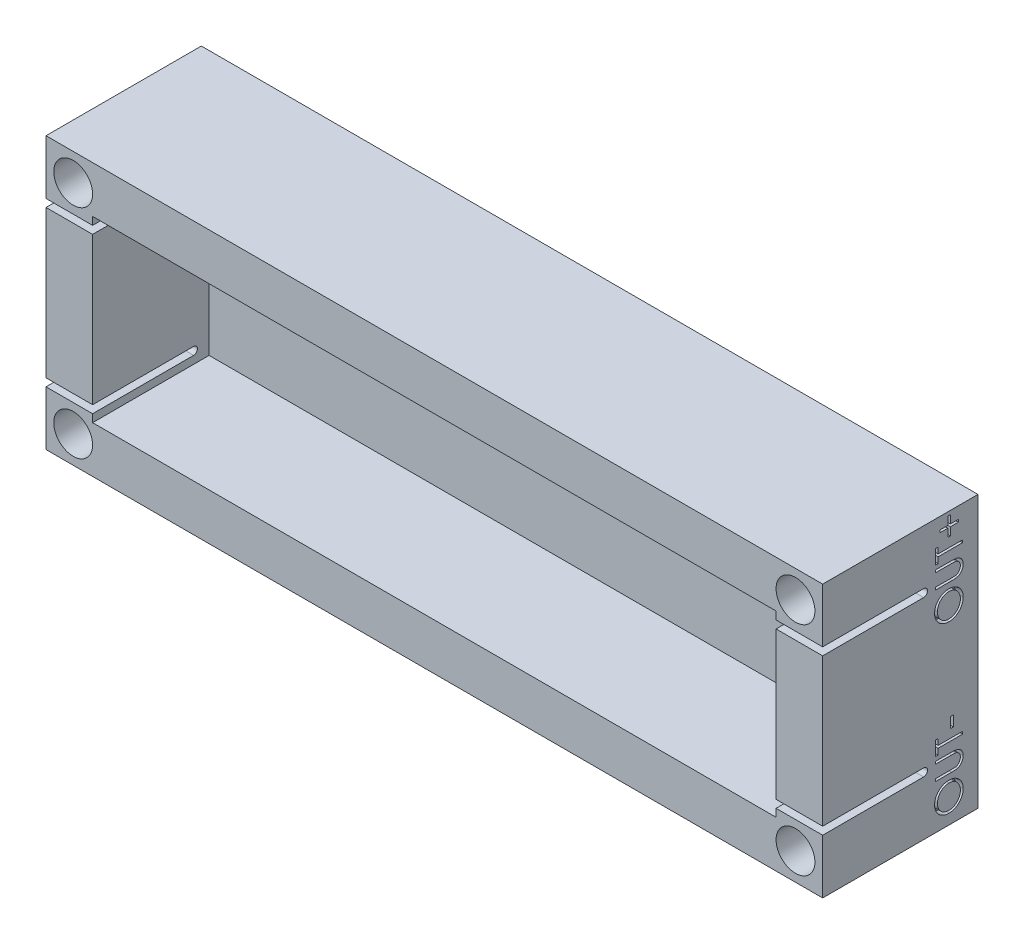
from build123d import *

# Parameters (mm, degrees)
SKETCH1_W           = 100
SKETCH1_H           = 35
BOSS_EXTRUDE1_DEPTH = 5
SKETCH2_W           = 100
SKETCH2_H           = 35
SKETCH2_W_2         = 88
SKETCH2_H_2         = 23
BOSS_EXTRUDE2_DEPTH = 15
CUT_EXTRUDE1_DEPTH  = 104.471010433
SKETCH4_W           = 3.5
SKETCH4_H           = 0.314102564
SKETCH4_W_2         = 0.358974359
SKETCH4_H_2         = 1.346153846
CUT_EXTRUDE2_DEPTH  = 1
SKETCH5_W           = 0.358974359
SKETCH5_H           = 1.346153846
CUT_EXTRUDE3_DEPTH  = 1
SKETCH6_R           = 2.5
CUT_EXTRUDE4_DEPTH  = 5


with BuildPart() as part:
    # Sketch1 → Boss-Extrude1 (new body)
    with BuildSketch(Plane.XY):
        Rectangle(SKETCH1_W, SKETCH1_H)
    extrude(amount=BOSS_EXTRUDE1_DEPTH)

    # Sketch2 → Boss-Extrude2 (add)
    with BuildSketch(Plane.XY.offset(5)):
        Rectangle(SKETCH2_W, SKETCH2_H)
        Rectangle(SKETCH2_W_2, SKETCH2_H_2, mode=Mode.SUBTRACT)
    extrude(amount=BOSS_EXTRUDE2_DEPTH)

    # Sketch3 → Cut-Extrude1 (cut, through all)
    with BuildSketch(Plane.ZY.offset(50)):
        with BuildLine():
            Line((20, 9.5), (7, 9.5))
            ThreePointArc((7, 9.5), (6.5, 10), (7, 10.5))
            Line((7, 10.5), (20, 10.5))
            ThreePointArc((20, 10.5), (20.5, 10), (20, 9.5))
        make_face()
        with BuildLine():
            Line((20, -10.5), (7, -10.5))
            ThreePointArc((7, -10.5), (6.5, -10), (7, -9.5))
            Line((7, -9.5), (20, -9.5))
            ThreePointArc((20, -9.5), (20.5, -10), (20, -10.5))
        make_face()
    extrude(amount=-CUT_EXTRUDE1_DEPTH, mode=Mode.SUBTRACT)

    # Sketch4 → Cut-Extrude2 (cut)
    with BuildSketch(Plane.ZY.offset(50)):
        with Locations((3.75, 12.425221733)):
            Rectangle(SKETCH4_W, SKETCH4_H)
        Polygon((2, 11.505349938), (5.5, 11.505349938), (5.5, 11.43944449), (2.745292468, 9.12714481), (5.5, 9.12714481), (5.5, 8.813042246), (2, 8.813042246), (2, 8.884556669), (4.748397436, 11.191247374), (2, 11.191247374), align=None)
        Polygon((3.884615385, 7.063042246), (4.916666667, 7.063042246), (4.916666667, 6.748939682), (3.884615385, 6.748939682), (3.884615385, 5.7168884), (3.570512821, 5.7168884), (3.570512821, 6.748939682), (2.538461538, 6.748939682), (2.538461538, 7.063042246), (3.570512821, 7.063042246), (3.570512821, 8.095093528), (3.884615385, 8.095093528), align=None)
        with Locations((3.75, -8.085547974)):
            Rectangle(SKETCH4_W, SKETCH4_H)
        Polygon((2, -9.005419769), (5.5, -9.005419769), (5.5, -9.071325218), (2.745292468, -11.383624897), (5.5, -11.383624897), (5.5, -11.697727461), (2, -11.697727461), (2, -11.626213038), (4.748397436, -9.319522333), (2, -9.319522333), align=None)
        with Locations((3.346153847, -12.954137718)):
            Rectangle(SKETCH4_W_2, SKETCH4_H_2)
    extrude(amount=-CUT_EXTRUDE2_DEPTH, mode=Mode.SUBTRACT)

    # Sketch5 → Cut-Extrude3 (cut)
    # profile 1 of 8: a face of its own
    with BuildSketch(Plane(origin=(50, 0, 0), x_dir=(0, 0, -1), z_dir=(1, 0, 0))):
        with BuildLine():
            add(Edge.make_bspline(
                [(-5.58974359, -14.357953129), (-5.588129744, -14.293137957), (-5.584960018, -14.165835611), (-5.559895231, -13.978914089), (-5.518641215, -13.799928351), (-5.460381735, -13.628775498), (-5.384855641, -13.466106469), (-5.293113066, -13.311461843), (-5.184596472, -13.165305074), (-5.060899323, -13.028642218), (-4.925430757, -12.903974033), (-4.780409088, -12.794577053), (-4.62765762, -12.702290377), (-4.467168388, -12.626743681), (-4.299316087, -12.567434518), (-4.123159994, -12.526518352), (-3.939853875, -12.500379416), (-3.814826932, -12.497323746), (-3.751402244, -12.495773642)],
                knots=[0, 0, 0, 0, 1.065064174, 2.09187391, 3.093564831, 4.079973196, 5.057907931, 6.036227367, 7.030399151, 8.044883615, 9.061699972, 10.052012555, 11.025713132, 11.989727027, 12.962874294, 13.945865945, 14.957962116, 16, 16, 16, 16], degree=3))
            add(Edge.make_bspline(
                [(-3.751402244, -12.495773642), (-3.688445124, -12.497324268), (-3.564349346, -12.500380733), (-3.382201223, -12.526539561), (-3.207127705, -12.567617088), (-3.039519009, -12.626009353), (-2.879355736, -12.70161402), (-2.726488631, -12.794036556), (-2.581079609, -12.903225913), (-2.444677774, -13.027364693), (-2.319901677, -13.163091329), (-2.2098443, -13.307555638), (-2.11751745, -13.460303032), (-2.041127343, -13.619750597), (-1.983054174, -13.787150366), (-1.94077499, -13.961284167), (-1.914895539, -14.14310074), (-1.911819755, -14.26695579), (-1.91025641, -14.329908257)],
                knots=[0, 0, 0, 0, 1.043748596, 2.057349401, 3.045489418, 4.02252776, 4.995289225, 5.97782527, 6.980224157, 8.006516136, 9.032559198, 10.034193337, 11.013412982, 11.987833483, 12.961212594, 13.946489799, 14.956251404, 16, 16, 16, 16], degree=3))
            add(Edge.make_bspline(
                [(-1.91025641, -14.329908257), (-1.911805797, -14.393332576), (-1.914860051, -14.518358792), (-1.941041456, -14.701895827), (-1.98198276, -14.878173571), (-2.040492196, -15.046687922), (-2.116109427, -15.207532852), (-2.208313806, -15.361022935), (-2.317720947, -15.506542082), (-2.441887521, -15.642883828), (-2.577059073, -15.767633027), (-2.721893329, -15.876392402), (-2.873548785, -15.968617516), (-3.032446309, -16.043980848), (-3.197817752, -16.103645307), (-3.370766229, -16.144350126), (-3.550305735, -16.170686078), (-3.672548634, -16.173720924), (-3.734575321, -16.175260821)],
                knots=[0, 0, 0, 0, 1.053102029, 2.075944431, 3.073151272, 4.055350789, 5.033113405, 6.020478099, 7.024410459, 8.052272461, 9.079885166, 10.07527673, 11.055994387, 12.023226415, 12.992069828, 13.970394897, 14.97016774, 16, 16, 16, 16], degree=3))
            add(Edge.make_bspline(
                [(-3.734575321, -16.175260821), (-3.77620799, -16.174726186), (-3.858948113, -16.173663659), (-3.981814713, -16.160871967), (-4.102705371, -16.142310266), (-4.221276319, -16.115708353), (-4.337237304, -16.080916686), (-4.451388067, -16.039864659), (-4.56257179, -15.989724813), (-4.671315182, -15.933044165), (-4.775923088, -15.869782357), (-4.874802671, -15.799906608), (-4.968783668, -15.725871239), (-5.055430672, -15.644707846), (-5.137264328, -15.559091401), (-5.213027045, -15.467633022), (-5.283401996, -15.370890778), (-5.346822337, -15.268448398), (-5.404181472, -15.162830123), (-5.453403323, -15.053953346), (-5.495649384, -14.943296774), (-5.529890209, -14.830342126), (-5.556922245, -14.715389354), (-5.575329599, -14.598187569), (-5.588153917, -14.478830143), (-5.589211419, -14.398418824), (-5.58974359, -14.357953129)],
                knots=[0, 0, 0, 0, 1.037015668, 2.060948919, 3.074880161, 4.083647147, 5.086022904, 6.090072063, 7.104153813, 8.122640571, 9.144368836, 10.147691507, 11.138137339, 12.123020368, 13.103399296, 14.087645067, 15.080126199, 16.082011238, 17.087798457, 18.072939717, 19.057185487, 20.037253025, 21.01195951, 21.997135196, 22.992090687, 24, 24, 24, 24], degree=3))
        make_face()
        with BuildLine():
            add(Edge.make_bspline(
                [(-5.230769231, -14.342528449), (-5.230365753, -14.375743508), (-5.229562654, -14.441856086), (-5.21892606, -14.540134342), (-5.203874783, -14.637149922), (-5.182015052, -14.732715087), (-5.153740439, -14.827030256), (-5.119639024, -14.9201373), (-5.078422353, -15.011716987), (-5.032069199, -15.101654907), (-4.979419431, -15.187873789), (-4.92351052, -15.270581273), (-4.862265147, -15.347626067), (-4.797007836, -15.420066552), (-4.727172255, -15.487722574), (-4.653217023, -15.550564292), (-4.574822262, -15.608540172), (-4.492310601, -15.660952501), (-4.40614272, -15.707595382), (-4.317965778, -15.749356709), (-4.226743513, -15.783975256), (-4.133045178, -15.811398302), (-4.037283681, -15.834674186), (-3.93893728, -15.849274542), (-3.838345009, -15.86001594), (-3.770362768, -15.860774553), (-3.735977564, -15.861158257)],
                knots=[0, 0, 0, 0, 1.008406545, 2.007172654, 2.999155034, 3.989332444, 4.982025741, 5.988181096, 6.998684226, 8.030553839, 9.059268815, 10.065399129, 11.060956322, 12.046057109, 13.024974577, 14.012068307, 14.991706172, 15.984221787, 16.978487447, 17.966117052, 18.945677757, 19.938371053, 20.93015022, 21.936155317, 22.956113857, 24, 24, 24, 24], degree=3))
            add(Edge.make_bspline(
                [(-3.735977564, -15.861158257), (-3.685416493, -15.859880478), (-3.585947224, -15.857366692), (-3.440162679, -15.835450738), (-3.299921154, -15.801424055), (-3.166058545, -15.752091792), (-3.037977921, -15.689158755), (-2.916177726, -15.612393227), (-2.80069389, -15.521092197), (-2.692386073, -15.417443244), (-2.593568594, -15.304105846), (-2.50670751, -15.183815892), (-2.433602799, -15.057525071), (-2.372488904, -14.92596129), (-2.326448237, -14.788001281), (-2.293621264, -14.64452959), (-2.272345169, -14.495543047), (-2.270278754, -14.394017352), (-2.269230769, -14.342528449)],
                knots=[0, 0, 0, 0, 1.032022337, 2.030307203, 3.003823408, 3.974715386, 4.937372378, 5.913284036, 6.909147208, 7.938749767, 8.970518239, 9.975863271, 10.963918693, 11.946286286, 12.933361397, 13.927862637, 14.949112547, 16, 16, 16, 16], degree=3))
            add(Edge.make_bspline(
                [(-2.269230769, -14.342528449), (-2.26970589, -14.307918812), (-2.270648197, -14.239277505), (-2.280152496, -14.137183979), (-2.295363267, -14.036920277), (-2.317371822, -13.938671652), (-2.344552167, -13.842309379), (-2.378266584, -13.748124215), (-2.418682089, -13.656147443), (-2.463723833, -13.565926794), (-2.514890039, -13.479482395), (-2.570045247, -13.397276596), (-2.630209968, -13.320364538), (-2.694590845, -13.247958042), (-2.764211752, -13.180776173), (-2.837717532, -13.118113379), (-2.916278677, -13.061139918), (-2.99845239, -13.008905268), (-3.083992054, -12.961693273), (-3.172411414, -12.921139904), (-3.263236245, -12.886506487), (-3.356533279, -12.85858803), (-3.452092652, -12.836699855), (-3.550051131, -12.821620672), (-3.650210365, -12.811072034), (-3.717954236, -12.810276984), (-3.752103365, -12.809876206)],
                knots=[0, 0, 0, 0, 1.047334373, 2.07717862, 3.100662057, 4.115010574, 5.122652213, 6.129548646, 7.140165612, 8.16200981, 9.179904151, 10.178566626, 11.156366481, 12.133321541, 13.108841334, 14.082538371, 15.054589433, 16.043660176, 17.028268541, 18.009491307, 18.985652105, 19.968123554, 20.954864208, 21.950389976, 22.966808393, 24, 24, 24, 24], degree=3))
            add(Edge.make_bspline(
                [(-3.752103365, -12.809876206), (-3.78601887, -12.810277319), (-3.85329652, -12.811073), (-3.952757338, -12.821615475), (-4.05001055, -12.836716365), (-4.144674352, -12.858479073), (-4.236772879, -12.886529226), (-4.326219621, -12.92111656), (-4.413347837, -12.961901846), (-4.497942055, -13.008710124), (-4.579117087, -13.061325747), (-4.65671841, -13.118820733), (-4.729295218, -13.182183309), (-4.798614701, -13.249619703), (-4.863290324, -13.322751233), (-4.923072192, -13.401590662), (-4.980653876, -13.484174991), (-5.031614304, -13.572371804), (-5.0789118, -13.663067572), (-5.119263823, -13.756217214), (-5.153920496, -13.850490416), (-5.182099457, -13.946264101), (-5.20379105, -14.043492997), (-5.218939529, -14.142120562), (-5.229559, -14.241802531), (-5.23036454, -14.308846597), (-5.230769231, -14.342528449)],
                knots=[0, 0, 0, 0, 1.029877221, 2.042951179, 3.035109885, 4.018542222, 4.991021277, 5.957494829, 6.929429462, 7.911425532, 8.892163142, 9.866273635, 10.842761649, 11.81676864, 12.802607151, 13.805177466, 14.821356543, 15.858816981, 16.897175917, 17.927346774, 18.940346092, 19.946830556, 20.957962087, 21.964146003, 22.97721996, 24, 24, 24, 24], degree=3))
        make_face(mode=Mode.SUBTRACT)
    # profile 2 of 8: a face of its own
    with BuildSketch(Plane(origin=(50, 0, 0), x_dir=(0, 0, -1), z_dir=(1, 0, 0))):
        with BuildLine():
            Line((-5.5, -11.777824924), (-5.5, -11.46372236))
            Line((-5.5, -11.46372236), (-3.402944712, -11.46372236))
            add(Edge.make_bspline(
                [(-3.402944712, -11.46372236), (-3.373263976, -11.463769104), (-3.316939665, -11.463857808), (-3.236771364, -11.463265294), (-3.165498905, -11.461605926), (-3.102847558, -11.460559766), (-3.04910481, -11.458232433), (-3.0039795, -11.456334386), (-2.967685297, -11.453893829), (-2.946504371, -11.450960712), (-2.93739984, -11.449699924)],
                knots=[0, 0, 0, 0, 1.528628734, 2.90083645, 4.128790002, 5.200304208, 6.127813768, 6.898992206, 7.526736466, 8, 8, 8, 8], degree=3))
            add(Edge.make_bspline(
                [(-2.93739984, -11.449699924), (-2.904301233, -11.44458144), (-2.840405861, -11.434700439), (-2.749483191, -11.408448462), (-2.667388274, -11.373450347), (-2.592269338, -11.330033093), (-2.524603772, -11.275175204), (-2.463872235, -11.207067441), (-2.408682704, -11.126930884), (-2.360565368, -11.035913656), (-2.320599866, -10.93893464), (-2.290695413, -10.839470532), (-2.272393907, -10.739440988), (-2.27028033, -10.672463062), (-2.269230769, -10.639203129)],
                knots=[0, 0, 0, 0, 1.042777144, 2.01303441, 2.939567723, 3.817555404, 4.708046775, 5.641195415, 6.651191522, 7.732783915, 8.843021186, 9.914367358, 10.964315445, 12, 12, 12, 12], degree=3))
            add(Edge.make_bspline(
                [(-2.269230769, -10.639203129), (-2.270298667, -10.610646878), (-2.272428294, -10.55369931), (-2.285778381, -10.469130267), (-2.309364144, -10.38650458), (-2.341492259, -10.306471347), (-2.381001228, -10.230331242), (-2.428332331, -10.160036403), (-2.483463899, -10.097040813), (-2.544564893, -10.039553827), (-2.613418648, -9.98978865), (-2.688364059, -9.945788452), (-2.771399511, -9.910844206), (-2.82971969, -9.89315204), (-2.859575321, -9.884094956)],
                knots=[0, 0, 0, 0, 0.994718802, 1.98369237, 2.973235266, 3.981451368, 4.982709966, 5.955777334, 6.925228988, 7.892833478, 8.871333226, 9.877970804, 10.913677552, 12, 12, 12, 12], degree=3))
            add(Edge.make_bspline(
                [(-2.859575321, -9.884094956), (-2.871923895, -9.88109483), (-2.899441495, -9.874409342), (-2.945962785, -9.868162297), (-3.000852149, -9.861655772), (-3.064503962, -9.857141202), (-3.136704935, -9.852739981), (-3.217831192, -9.850106909), (-3.307588153, -9.848889876), (-3.370225315, -9.848527195), (-3.402944712, -9.848337744)],
                knots=[0, 0, 0, 0, 0.558680831, 1.244966039, 2.062412453, 2.990489873, 4.051219941, 5.244515665, 6.560634259, 8, 8, 8, 8], degree=3))
            Line((-3.402944712, -9.848337744), (-5.5, -9.848337744))
            Line((-5.5, -9.848337744), (-5.5, -9.53423518))
            Line((-5.5, -9.53423518), (-3.386117788, -9.53423518))
            add(Edge.make_bspline(
                [(-3.386117788, -9.53423518), (-3.348019417, -9.534489337), (-3.273668129, -9.534985339), (-3.164716665, -9.539285413), (-3.061364054, -9.546144188), (-2.963594286, -9.555826179), (-2.87176449, -9.5686841), (-2.785269805, -9.582850596), (-2.704587107, -9.601206878), (-2.628785526, -9.622488999), (-2.556264884, -9.646471043), (-2.48757401, -9.678077853), (-2.420695446, -9.713533552), (-2.356378054, -9.755245314), (-2.29503047, -9.80323288), (-2.235064641, -9.855657792), (-2.178267709, -9.914367875), (-2.123939175, -9.977629019), (-2.073413625, -10.045015885), (-2.029444943, -10.116963589), (-1.993642513, -10.193074915), (-1.961867151, -10.271547603), (-1.939282033, -10.354263081), (-1.922109536, -10.440191011), (-1.912434071, -10.529841074), (-1.910988451, -10.590804235), (-1.91025641, -10.621675084)],
                knots=[0, 0, 0, 0, 1.316707045, 2.569633854, 3.76780728, 4.896239288, 5.964314126, 6.972204208, 7.924543903, 8.822147865, 9.693191779, 10.560896119, 11.431827672, 12.307838457, 13.206132673, 14.12176355, 15.058527151, 16.026630406, 17.00238624, 17.966538933, 18.934743273, 19.906713913, 20.888635248, 21.892958714, 22.933025263, 24, 24, 24, 24], degree=3))
            add(Edge.make_bspline(
                [(-1.91025641, -10.621675084), (-1.911040632, -10.655344432), (-1.912579271, -10.721403574), (-1.921409724, -10.818738158), (-1.938000049, -10.912065047), (-1.95926136, -11.002295087), (-1.988105864, -11.088556554), (-2.023548065, -11.170824029), (-2.064010724, -11.250042114), (-2.111823734, -11.324426043), (-2.163960603, -11.394586012), (-2.221227237, -11.458345382), (-2.281442629, -11.51732269), (-2.346874192, -11.568918349), (-2.416182481, -11.615083876), (-2.489693486, -11.654801993), (-2.567308662, -11.688918466), (-2.621262289, -11.706524594), (-2.64853766, -11.715425084)],
                knots=[0, 0, 0, 0, 1.138939089, 2.234594419, 3.301501784, 4.342532435, 5.367382236, 6.373123747, 7.370098489, 8.372230273, 9.360297234, 10.323289009, 11.268038109, 12.20748145, 13.137029304, 14.081414587, 15.030090602, 16, 16, 16, 16], degree=3))
            add(Edge.make_bspline(
                [(-2.64853766, -11.715425084), (-2.667170235, -11.720602242), (-2.707584704, -11.731831613), (-2.774471192, -11.743856911), (-2.85148611, -11.753965993), (-2.938634728, -11.763471551), (-3.035984595, -11.769080509), (-3.143493511, -11.773997948), (-3.261291472, -11.777859566), (-3.343345988, -11.777836794), (-3.386117788, -11.777824924)],
                knots=[0, 0, 0, 0, 0.625038921, 1.35572334, 2.194682327, 3.136881307, 4.189498639, 5.346923369, 6.617055217, 8, 8, 8, 8], degree=3))
            Line((-3.386117788, -11.777824924), (-5.5, -11.777824924))
        make_face()
    # profile 3 of 8: a face of its own
    with BuildSketch(Plane(origin=(50, 0, 0), x_dir=(0, 0, -1), z_dir=(1, 0, 0))):
        Polygon((-5.141025641, -8.995773642), (-5.5, -8.995773642), (-5.5, -7.156030052), (-5.141025641, -7.156030052), (-5.141025641, -7.918850565), (-2, -7.918850565), (-2, -8.232953129), (-5.141025641, -8.232953129), align=None)
    # profile 4 of 8: a face of its own
    with BuildSketch(Plane(origin=(50, 0, 0), x_dir=(0, 0, -1), z_dir=(1, 0, 0))):
        with Locations((-3.346153847, -6.168850565)):
            Rectangle(SKETCH5_W, SKETCH5_H)
    # profile 5 of 8: a face of its own
    with BuildSketch(Plane(origin=(50, 0, 0), x_dir=(0, 0, -1), z_dir=(1, 0, 0))):
        with BuildLine():
            add(Edge.make_bspline(
                [(-5.58974359, 6.98971256), (-5.588129744, 7.054527732), (-5.584960018, 7.181830077), (-5.559895231, 7.368751599), (-5.518641215, 7.547737338), (-5.460381735, 7.71889019), (-5.384855641, 7.881559219), (-5.293113066, 8.036203845), (-5.184596472, 8.182360614), (-5.060899323, 8.31902347), (-4.925430757, 8.443691655), (-4.780409088, 8.553088635), (-4.62765762, 8.645375311), (-4.467168388, 8.720922007), (-4.299316087, 8.78023117), (-4.123159994, 8.821147336), (-3.939853875, 8.847286273), (-3.814826932, 8.850341942), (-3.751402244, 8.851892047)],
                knots=[0, 0, 0, 0, 1.065064174, 2.09187391, 3.093564831, 4.079973196, 5.057907931, 6.036227367, 7.030399151, 8.044883615, 9.061699972, 10.052012555, 11.025713132, 11.989727027, 12.962874294, 13.945865945, 14.957962116, 16, 16, 16, 16], degree=3))
            add(Edge.make_bspline(
                [(-3.751402244, 8.851892047), (-3.688445124, 8.85034142), (-3.564349346, 8.847284956), (-3.382201223, 8.821126127), (-3.207127705, 8.7800486), (-3.039519009, 8.721656335), (-2.879355736, 8.646051668), (-2.726488631, 8.553629132), (-2.581079609, 8.444439775), (-2.444677774, 8.320300995), (-2.319901677, 8.18457436), (-2.2098443, 8.04011005), (-2.11751745, 7.887362656), (-2.041127343, 7.727915091), (-1.983054174, 7.560515322), (-1.94077499, 7.386381521), (-1.914895539, 7.204564948), (-1.911819755, 7.080709899), (-1.91025641, 7.017757431)],
                knots=[0, 0, 0, 0, 1.043748596, 2.057349401, 3.045489418, 4.02252776, 4.995289225, 5.97782527, 6.980224157, 8.006516136, 9.032559198, 10.034193337, 11.013412982, 11.987833483, 12.961212594, 13.946489799, 14.956251404, 16, 16, 16, 16], degree=3))
            add(Edge.make_bspline(
                [(-1.91025641, 7.017757431), (-1.911805797, 6.954333112), (-1.914860051, 6.829306896), (-1.941041456, 6.645769861), (-1.98198276, 6.469492117), (-2.040492196, 6.300977766), (-2.116109427, 6.140132836), (-2.208313806, 5.986642754), (-2.317720947, 5.841123606), (-2.441887521, 5.70478186), (-2.577059073, 5.580032662), (-2.721893329, 5.471273286), (-2.873548785, 5.379048173), (-3.032446309, 5.30368484), (-3.197817752, 5.244020381), (-3.370766229, 5.203315563), (-3.550305735, 5.176979611), (-3.672548634, 5.173944764), (-3.734575321, 5.172404867)],
                knots=[0, 0, 0, 0, 1.053102029, 2.075944431, 3.073151272, 4.055350789, 5.033113405, 6.020478099, 7.024410459, 8.052272461, 9.079885166, 10.07527673, 11.055994387, 12.023226415, 12.992069828, 13.970394897, 14.97016774, 16, 16, 16, 16], degree=3))
            add(Edge.make_bspline(
                [(-3.734575321, 5.172404867), (-3.77620799, 5.172939503), (-3.858948113, 5.174002029), (-3.981814713, 5.186793722), (-4.102705371, 5.205355423), (-4.221276319, 5.231957335), (-4.337237304, 5.266749002), (-4.451388067, 5.30780103), (-4.56257179, 5.357940875), (-4.671315182, 5.414621523), (-4.775923088, 5.477883331), (-4.874802671, 5.547759081), (-4.968783668, 5.621794449), (-5.055430672, 5.702957843), (-5.137264328, 5.788574288), (-5.213027045, 5.880032666), (-5.283401996, 5.97677491), (-5.346822337, 6.07921729), (-5.404181472, 6.184835565), (-5.453403323, 6.293712343), (-5.495649384, 6.404368914), (-5.529890209, 6.517323562), (-5.556922245, 6.632276334), (-5.575329599, 6.749478119), (-5.588153917, 6.868835545), (-5.589211419, 6.949246864), (-5.58974359, 6.98971256)],
                knots=[0, 0, 0, 0, 1.037015668, 2.060948919, 3.074880161, 4.083647147, 5.086022904, 6.090072063, 7.104153813, 8.122640571, 9.144368836, 10.147691507, 11.138137339, 12.123020368, 13.103399296, 14.087645067, 15.080126199, 16.082011238, 17.087798457, 18.072939717, 19.057185487, 20.037253025, 21.01195951, 21.997135196, 22.992090687, 24, 24, 24, 24], degree=3))
        make_face()
        with BuildLine():
            add(Edge.make_bspline(
                [(-5.230769231, 7.005137239), (-5.230365753, 6.971922181), (-5.229562654, 6.905809602), (-5.21892606, 6.807531346), (-5.203874783, 6.710515766), (-5.182015052, 6.614950601), (-5.153740439, 6.520635433), (-5.119639024, 6.427528388), (-5.078422353, 6.335948702), (-5.032069199, 6.246010782), (-4.979419431, 6.159791899), (-4.92351052, 6.077084415), (-4.862265147, 6.000039621), (-4.797007836, 5.927599136), (-4.727172255, 5.859943114), (-4.653217023, 5.797101396), (-4.574822262, 5.739125516), (-4.492310601, 5.686713187), (-4.40614272, 5.640070306), (-4.317965778, 5.598308979), (-4.226743513, 5.563690433), (-4.133045178, 5.536267386), (-4.037283681, 5.512991503), (-3.93893728, 5.498391146), (-3.838345009, 5.487649749), (-3.770362768, 5.486891136), (-3.735977564, 5.486507431)],
                knots=[0, 0, 0, 0, 1.008406545, 2.007172654, 2.999155034, 3.989332444, 4.982025741, 5.988181096, 6.998684226, 8.030553839, 9.059268815, 10.065399129, 11.060956322, 12.046057109, 13.024974577, 14.012068307, 14.991706172, 15.984221787, 16.978487447, 17.966117052, 18.945677757, 19.938371053, 20.93015022, 21.936155317, 22.956113857, 24, 24, 24, 24], degree=3))
            add(Edge.make_bspline(
                [(-3.735977564, 5.486507431), (-3.685416493, 5.48778521), (-3.585947224, 5.490298996), (-3.440162679, 5.51221495), (-3.299921154, 5.546241633), (-3.166058545, 5.595573897), (-3.037977921, 5.658506933), (-2.916177726, 5.735272461), (-2.80069389, 5.826573491), (-2.692386073, 5.930222444), (-2.593568594, 6.043559842), (-2.50670751, 6.163849796), (-2.433602799, 6.290140618), (-2.372488904, 6.421704399), (-2.326448237, 6.559664407), (-2.293621264, 6.703136098), (-2.272345169, 6.852122642), (-2.270278754, 6.953648336), (-2.269230769, 7.005137239)],
                knots=[0, 0, 0, 0, 1.032022337, 2.030307203, 3.003823408, 3.974715386, 4.937372378, 5.913284036, 6.909147208, 7.938749767, 8.970518239, 9.975863271, 10.963918693, 11.946286286, 12.933361397, 13.927862637, 14.949112547, 16, 16, 16, 16], degree=3))
            add(Edge.make_bspline(
                [(-2.269230769, 7.005137239), (-2.26970589, 7.039746877), (-2.270648197, 7.108388183), (-2.280152496, 7.21048171), (-2.295363267, 7.310745412), (-2.317371822, 7.408994036), (-2.344552167, 7.50535631), (-2.378266584, 7.599541474), (-2.418682089, 7.691518245), (-2.463723833, 7.781738894), (-2.514890039, 7.868183293), (-2.570045247, 7.950389092), (-2.630209968, 8.02730115), (-2.694590845, 8.099707647), (-2.764211752, 8.166889515), (-2.837717532, 8.229552309), (-2.916278677, 8.286525771), (-2.99845239, 8.33876042), (-3.083992054, 8.385972416), (-3.172411414, 8.426525785), (-3.263236245, 8.461159201), (-3.356533279, 8.489077658), (-3.452092652, 8.510965833), (-3.550051131, 8.526045017), (-3.650210365, 8.536593654), (-3.717954236, 8.537388704), (-3.752103365, 8.537789483)],
                knots=[0, 0, 0, 0, 1.047334373, 2.07717862, 3.100662057, 4.115010574, 5.122652213, 6.129548646, 7.140165612, 8.16200981, 9.179904151, 10.178566626, 11.156366481, 12.133321541, 13.108841334, 14.082538371, 15.054589433, 16.043660176, 17.028268541, 18.009491307, 18.985652105, 19.968123554, 20.954864208, 21.950389976, 22.966808393, 24, 24, 24, 24], degree=3))
            add(Edge.make_bspline(
                [(-3.752103365, 8.537789483), (-3.78601887, 8.53738837), (-3.85329652, 8.536592688), (-3.952757338, 8.526050214), (-4.05001055, 8.510949323), (-4.144674352, 8.489186615), (-4.236772879, 8.461136462), (-4.326219621, 8.426549128), (-4.413347837, 8.385763843), (-4.497942055, 8.338955565), (-4.579117087, 8.286339941), (-4.65671841, 8.228844955), (-4.729295218, 8.16548238), (-4.798614701, 8.098045986), (-4.863290324, 8.024914455), (-4.923072192, 7.946075026), (-4.980653876, 7.863490697), (-5.031614304, 7.775293884), (-5.0789118, 7.684598116), (-5.119263823, 7.591448474), (-5.153920496, 7.497175272), (-5.182099457, 7.401401588), (-5.20379105, 7.304172692), (-5.218939529, 7.205545126), (-5.229559, 7.105863157), (-5.23036454, 7.038819091), (-5.230769231, 7.005137239)],
                knots=[0, 0, 0, 0, 1.029877221, 2.042951179, 3.035109885, 4.018542222, 4.991021277, 5.957494829, 6.929429462, 7.911425532, 8.892163142, 9.866273635, 10.842761649, 11.81676864, 12.802607151, 13.805177466, 14.821356543, 15.858816981, 16.897175917, 17.927346774, 18.940346092, 19.946830556, 20.957962087, 21.964146003, 22.97721996, 24, 24, 24, 24], degree=3))
        make_face(mode=Mode.SUBTRACT)
    # profile 6 of 8: a face of its own
    with BuildSketch(Plane(origin=(50, 0, 0), x_dir=(0, 0, -1), z_dir=(1, 0, 0))):
        with BuildLine():
            Line((-5.5, 9.569840765), (-5.5, 9.883943329))
            Line((-5.5, 9.883943329), (-3.402944712, 9.883943329))
            add(Edge.make_bspline(
                [(-3.402944712, 9.883943329), (-3.373263976, 9.883896585), (-3.316939665, 9.88380788), (-3.236771364, 9.884400394), (-3.165498905, 9.886059762), (-3.102847558, 9.887105922), (-3.04910481, 9.889433255), (-3.0039795, 9.891331302), (-2.967685297, 9.893771859), (-2.946504371, 9.896704977), (-2.93739984, 9.897965765)],
                knots=[0, 0, 0, 0, 1.528628734, 2.90083645, 4.128790002, 5.200304208, 6.127813768, 6.898992206, 7.526736466, 8, 8, 8, 8], degree=3))
            add(Edge.make_bspline(
                [(-2.93739984, 9.897965765), (-2.904301233, 9.903084248), (-2.840405861, 9.91296525), (-2.749483191, 9.939217227), (-2.667388274, 9.974215341), (-2.592269338, 10.017632596), (-2.524603772, 10.072490485), (-2.463872235, 10.140598247), (-2.408682704, 10.220734804), (-2.360565368, 10.311752032), (-2.320599866, 10.408731049), (-2.290695413, 10.508195156), (-2.272393907, 10.6082247), (-2.27028033, 10.675202626), (-2.269230769, 10.70846256)],
                knots=[0, 0, 0, 0, 1.042777144, 2.01303441, 2.939567723, 3.817555404, 4.708046775, 5.641195415, 6.651191522, 7.732783915, 8.843021186, 9.914367358, 10.964315445, 12, 12, 12, 12], degree=3))
            add(Edge.make_bspline(
                [(-2.269230769, 10.70846256), (-2.270298667, 10.73701881), (-2.272428294, 10.793966378), (-2.285778381, 10.878535421), (-2.309364144, 10.961161108), (-2.341492259, 11.041194342), (-2.381001228, 11.117334446), (-2.428332331, 11.187629285), (-2.483463899, 11.250624875), (-2.544564893, 11.308111862), (-2.613418648, 11.357877039), (-2.688364059, 11.401877236), (-2.771399511, 11.436821483), (-2.82971969, 11.454513648), (-2.859575321, 11.463570733)],
                knots=[0, 0, 0, 0, 0.994718802, 1.98369237, 2.973235266, 3.981451368, 4.982709966, 5.955777334, 6.925228988, 7.892833478, 8.871333226, 9.877970804, 10.913677552, 12, 12, 12, 12], degree=3))
            add(Edge.make_bspline(
                [(-2.859575321, 11.463570733), (-2.871923895, 11.466570858), (-2.899441495, 11.473256346), (-2.945962785, 11.479503391), (-3.000852149, 11.486009917), (-3.064503962, 11.490524487), (-3.136704935, 11.494925707), (-3.217831192, 11.49755878), (-3.307588153, 11.498775813), (-3.370225315, 11.499138493), (-3.402944712, 11.499327944)],
                knots=[0, 0, 0, 0, 0.558680831, 1.244966039, 2.062412453, 2.990489873, 4.051219941, 5.244515665, 6.560634259, 8, 8, 8, 8], degree=3))
            Line((-3.402944712, 11.499327944), (-5.5, 11.499327944))
            Line((-5.5, 11.499327944), (-5.5, 11.813430508))
            Line((-5.5, 11.813430508), (-3.386117788, 11.813430508))
            add(Edge.make_bspline(
                [(-3.386117788, 11.813430508), (-3.348019417, 11.813176352), (-3.273668129, 11.81268035), (-3.164716665, 11.808380276), (-3.061364054, 11.801521501), (-2.963594286, 11.791839509), (-2.87176449, 11.778981589), (-2.785269805, 11.764815092), (-2.704587107, 11.74645881), (-2.628785526, 11.725176689), (-2.556264884, 11.701194646), (-2.48757401, 11.669587836), (-2.420695446, 11.634132137), (-2.356378054, 11.592420375), (-2.29503047, 11.544432808), (-2.235064641, 11.492007897), (-2.178267709, 11.433297813), (-2.123939175, 11.370036669), (-2.073413625, 11.302649803), (-2.029444943, 11.230702099), (-1.993642513, 11.154590773), (-1.961867151, 11.076118085), (-1.939282033, 10.993402607), (-1.922109536, 10.907474677), (-1.912434071, 10.817824615), (-1.910988451, 10.756861453), (-1.91025641, 10.725990604)],
                knots=[0, 0, 0, 0, 1.316707045, 2.569633854, 3.76780728, 4.896239288, 5.964314126, 6.972204208, 7.924543903, 8.822147865, 9.693191779, 10.560896119, 11.431827672, 12.307838457, 13.206132673, 14.12176355, 15.058527151, 16.026630406, 17.00238624, 17.966538933, 18.934743273, 19.906713913, 20.888635248, 21.892958714, 22.933025263, 24, 24, 24, 24], degree=3))
            add(Edge.make_bspline(
                [(-1.91025641, 10.725990604), (-1.911040632, 10.692321256), (-1.912579271, 10.626262115), (-1.921409724, 10.52892753), (-1.938000049, 10.435600641), (-1.95926136, 10.345370602), (-1.988105864, 10.259109134), (-2.023548065, 10.176841659), (-2.064010724, 10.097623575), (-2.111823734, 10.023239645), (-2.163960603, 9.953079676), (-2.221227237, 9.889320306), (-2.281442629, 9.830342998), (-2.346874192, 9.77874734), (-2.416182481, 9.732581812), (-2.489693486, 9.692863696), (-2.567308662, 9.658747223), (-2.621262289, 9.641141094), (-2.64853766, 9.632240604)],
                knots=[0, 0, 0, 0, 1.138939089, 2.234594419, 3.301501784, 4.342532435, 5.367382236, 6.373123747, 7.370098489, 8.372230273, 9.360297234, 10.323289009, 11.268038109, 12.20748145, 13.137029304, 14.081414587, 15.030090602, 16, 16, 16, 16], degree=3))
            add(Edge.make_bspline(
                [(-2.64853766, 9.632240604), (-2.667170235, 9.627063446), (-2.707584704, 9.615834075), (-2.774471192, 9.603808777), (-2.85148611, 9.593699696), (-2.938634728, 9.584194137), (-3.035984595, 9.578585179), (-3.143493511, 9.573667741), (-3.261291472, 9.569806122), (-3.343345988, 9.569828894), (-3.386117788, 9.569840765)],
                knots=[0, 0, 0, 0, 0.625038921, 1.35572334, 2.194682327, 3.136881307, 4.189498639, 5.346923369, 6.617055217, 8, 8, 8, 8], degree=3))
            Line((-3.386117788, 9.569840765), (-5.5, 9.569840765))
        make_face()
    # profile 7 of 8: a face of its own
    with BuildSketch(Plane(origin=(50, 0, 0), x_dir=(0, 0, -1), z_dir=(1, 0, 0))):
        Polygon((-5.141025641, 12.351892047), (-5.5, 12.351892047), (-5.5, 14.191635637), (-5.141025641, 14.191635637), (-5.141025641, 13.428815124), (-2, 13.428815124), (-2, 13.11471256), (-5.141025641, 13.11471256), align=None)
    # profile 8 of 8: a face of its own
    with BuildSketch(Plane(origin=(50, 0, 0), x_dir=(0, 0, -1), z_dir=(1, 0, 0))):
        Polygon((-3.884615385, 15.672404867), (-4.916666667, 15.672404867), (-4.916666667, 15.986507431), (-3.884615385, 15.986507431), (-3.884615385, 17.018558713), (-3.570512821, 17.018558713), (-3.570512821, 15.986507431), (-2.538461538, 15.986507431), (-2.538461538, 15.672404867), (-3.570512821, 15.672404867), (-3.570512821, 14.640353585), (-3.884615385, 14.640353585), align=None)
    extrude(amount=-CUT_EXTRUDE3_DEPTH, mode=Mode.SUBTRACT)

    # Sketch6 → Cut-Extrude4 (cut)
    with BuildSketch(Plane.XY.offset(20)):
        with Locations((-46.5, 14)):
            Circle(SKETCH6_R)
        with Locations((-46.5, -14)):
            Circle(SKETCH6_R)
        with Locations((46.5, 14)):
            Circle(SKETCH6_R)
        with Locations((46.5, -14)):
            Circle(SKETCH6_R)
    extrude(amount=-CUT_EXTRUDE4_DEPTH, mode=Mode.SUBTRACT)


solid = part.part
